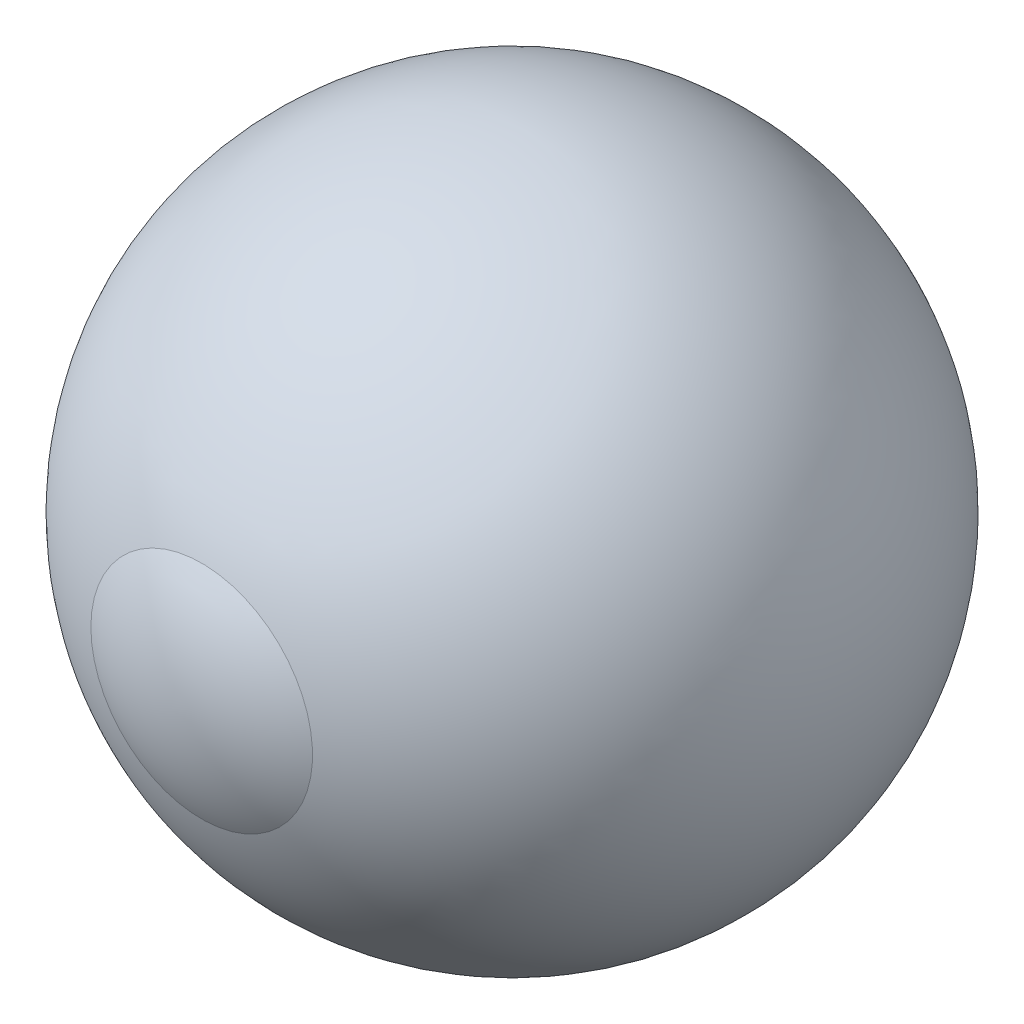
from build123d import *


with BuildPart() as part:
    # Sketch2 → eye_revolve (revolve)
    with BuildSketch(Plane(origin=(0, 0, 0), x_dir=(1, 0, 0), z_dir=(0, 1, 0))):
        with BuildLine():
            Line((0, 11.893055118), (0, -12.303944882))
            ThreePointArc((0, -12.303944882), (-2.074742464, -12.022950382), (-4, -11.200212499))
            ThreePointArc((-4, -11.200212499), (-11.71856443, 2.029780216), (0, 11.893055118))
        make_face()
    revolve(axis=Axis((0, 0, -11.893055118), (0, 0, 1)))


solid = part.part
